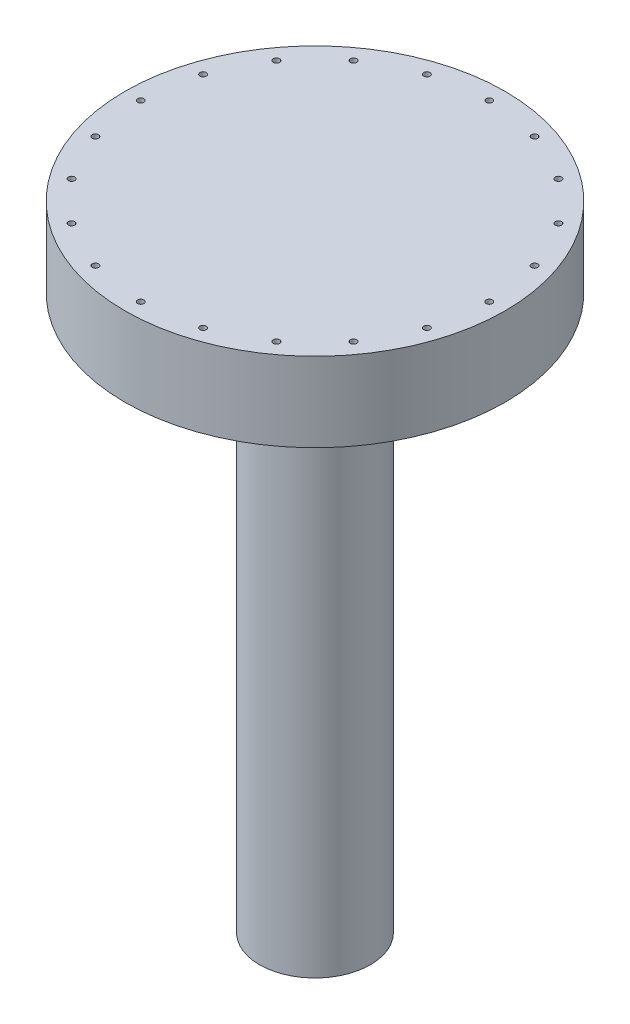
from build123d import *

# Parameters (mm, degrees)
SKETCH1_R           = 3.5
BOSS_EXTRUDE1_DEPTH = 35
SKETCH2_R           = 12
BOSS_EXTRUDE2_DEPTH = 5
SKETCH3_R           = 0.2
CUT_EXTRUDE1_DEPTH  = 5
CIRPATTERN1_COUNT   = 20


with BuildPart() as part:
    # Sketch1 → Boss-Extrude1 (new body)
    with BuildSketch(Plane(origin=(0, 0, 0), x_dir=(1, 0, 0), z_dir=(0, 1, 0))):
        with Locations(Location((0, 0, 0), (0, 0, 270))):
            Circle(SKETCH1_R)
    extrude(amount=BOSS_EXTRUDE1_DEPTH)

    # Sketch2 → Boss-Extrude2 (add)
    with BuildSketch(Plane(origin=(0, 35, 0), x_dir=(1, 0, 0), z_dir=(0, 1, 0))):
        with Locations(Location((0, 0, 0), (0, 0, 270))):
            Circle(SKETCH2_R)
    extrude(amount=BOSS_EXTRUDE2_DEPTH)

    # Sketch3 → Cut-Extrude1 (cut)
    with BuildSketch(Plane(origin=(0, 40, 0), x_dir=(1, 0, 0), z_dir=(0, 1, 0))):
        with Locations(Location((0, 11, 0), (0, 0, 270))):
            Circle(SKETCH3_R)
    cut_extrude1 = extrude(amount=-CUT_EXTRUDE1_DEPTH, mode=Mode.SUBTRACT)

    # CirPattern1: Cut-Extrude1 ×20 about axis
    cirpattern1_axis = Axis((0, 0, 0), (0, 1, 0))
    for i in range(1, CIRPATTERN1_COUNT):
        add(cut_extrude1.rotate(cirpattern1_axis, i * 360 / CIRPATTERN1_COUNT), mode=Mode.SUBTRACT)


solid = part.part
